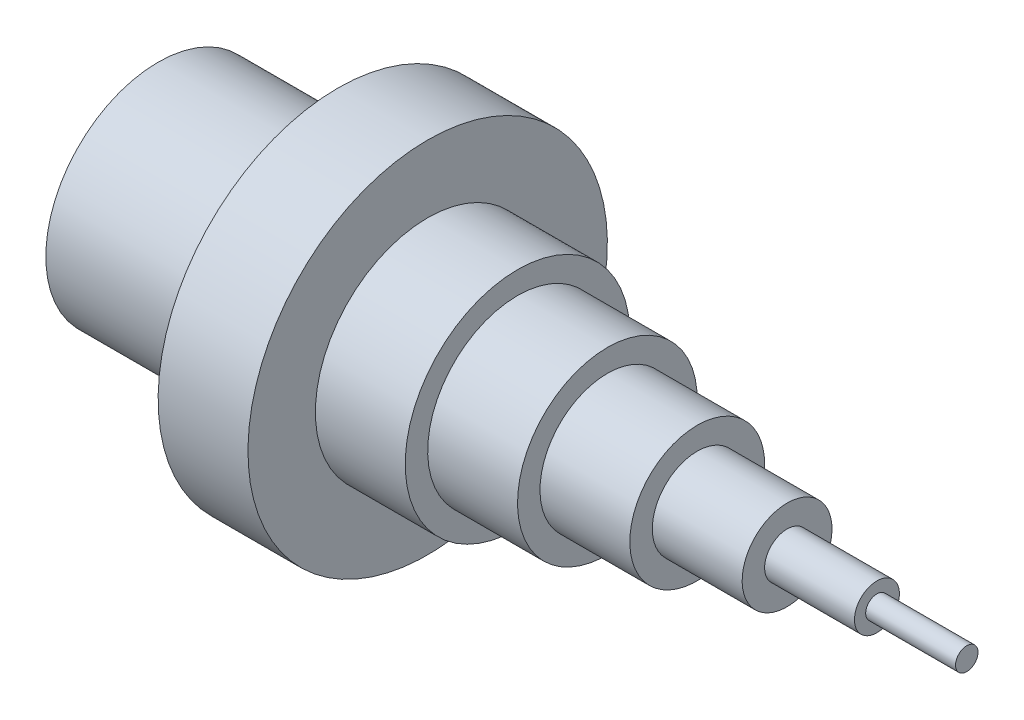
from build123d import *


with BuildPart() as part:
    # Sketch1 → Revolve1 (revolve)
    with BuildSketch(Plane.XY):
        Polygon((0, 40), (20, 40), (20, 25), (40, 25), (40, 20), (60, 20), (60, 15), (80, 15), (80, 10), (100, 10), (100, 5), (120, 5), (120, 2.5), (140, 2.5), (140, 0), (0, 0), (0, 20), (-40, 20), (-40, 25), (0, 25), align=None)
    revolve(axis=Axis((140, 0, 0), (-1, 0, 0)))


solid = part.part
